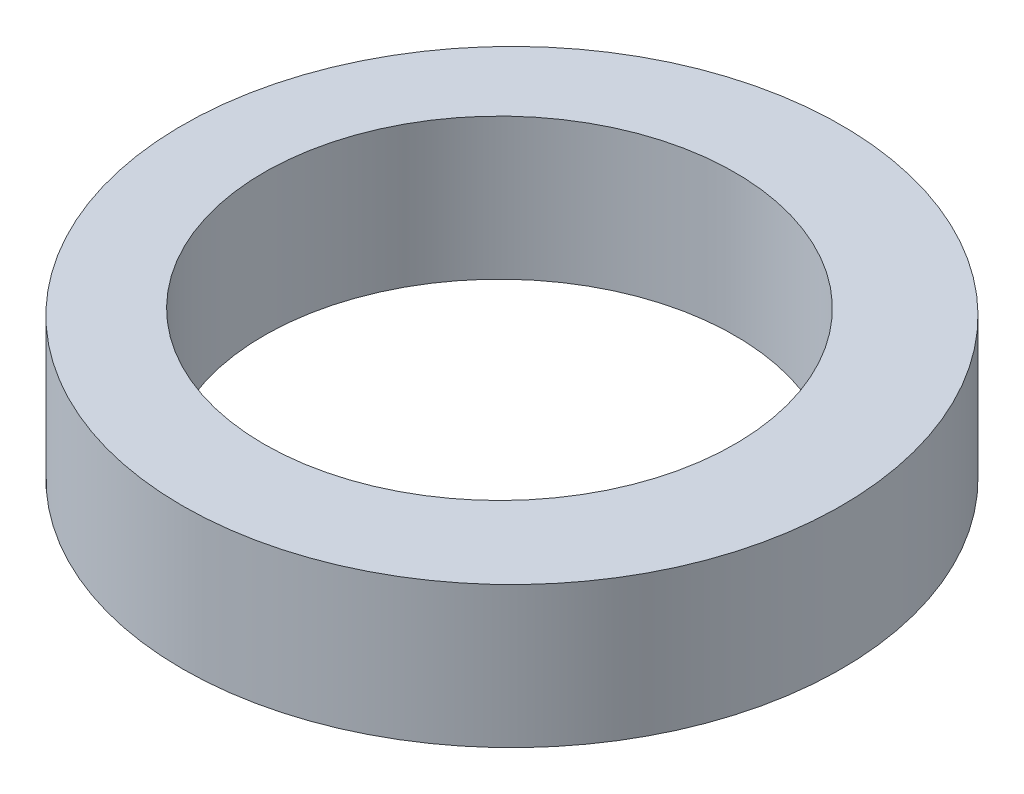
from build123d import *

# Parameters (mm, degrees)
SKETCH_1_R      = 17.5
SKETCH_1_R_2    = 12.5
EXTRUDE_1_DEPTH = 7.5


with BuildPart() as part:
    # 草图1 → 凸台-拉伸1 (new body)
    with BuildSketch(Plane(origin=(0, 0, 0), x_dir=(1, 0, 0), z_dir=(0, 1, 0))):
        with Locations(Location((0.661647637, 0, 0), (0, 0, 270))):
            Circle(SKETCH_1_R)
        with Locations(Location((0, 0, 0), (0, 0, 270))):
            Circle(SKETCH_1_R_2, mode=Mode.SUBTRACT)
    extrude(amount=EXTRUDE_1_DEPTH)


solid = part.part
